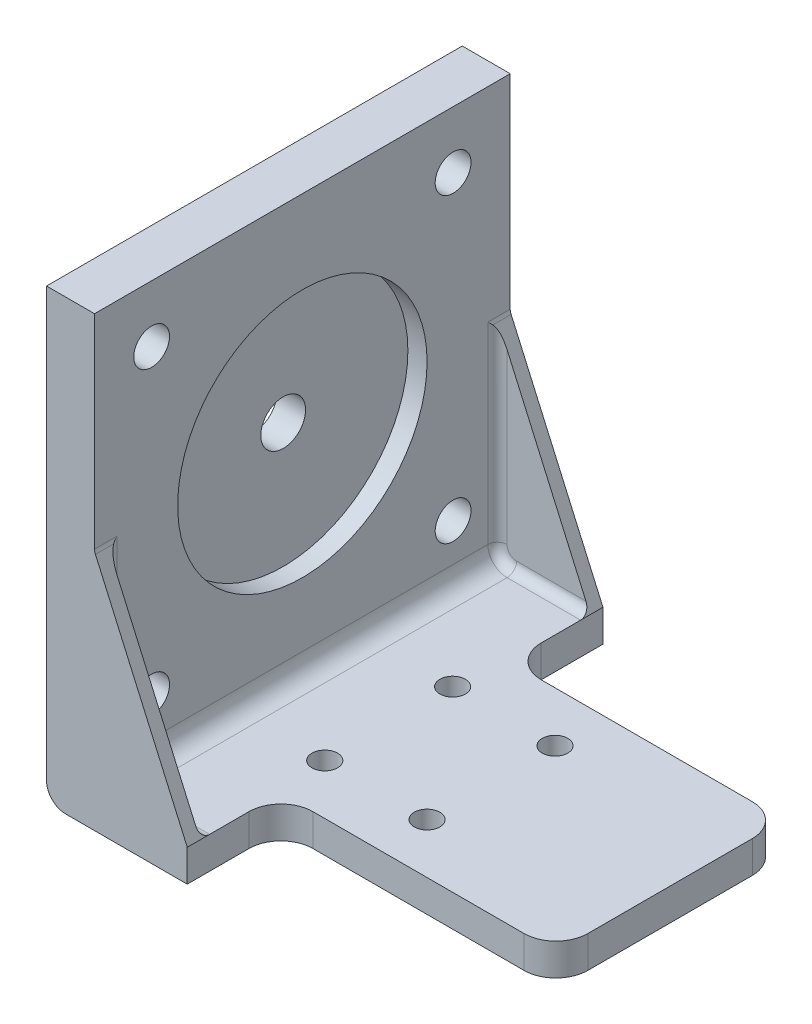
from build123d import *

# Parameters (mm, degrees)
BOSS_EXTRUDE1_DEPTH     = 5
SKETCH2_W               = 7.5
SKETCH2_H               = 65
BOSS_EXTRUDE2_DEPTH     = 65
FILLET2_R               = 3
SKETCH4_R               = 2.8
SKETCH4_R_2             = 3.5
CUT_EXTRUDE2_DEPTH      = 97.241882775
SKETCH6_R               = 2
CUT_EXTRUDE3_DEPTH      = 80.60841664
SKETCH7_R               = 19.5
CUT_EXTRUDE4_DEPTH      = 3
SKETCH8_W               = 2
SKETCH8_H               = 32.5
BOSS_EXTRUDE3_DEPTH     = 32.5
CUT_EXTRUDE5_DEPTH      = 101.902180353
FILLET3_R               = 3
FILLET4_R               = 1.5
CUT_EXTRUDE6_DEPTH      = 5
FILLET5_R               = 5
CUT_EXTRUDE7_DEPTH      = 101.902180353
CUT_EXTRUDE7_DEPTH_BACK = 101.902180353


with BuildPart() as part:
    # Sketch1 → Boss-Extrude1 (new body)
    with BuildSketch(Plane(origin=(0, 0, 0), x_dir=(1, 0, 0), z_dir=(0, 1, 0))):
        with BuildLine():
            Line((-32.5, 32.5), (27.5, 32.5))
            ThreePointArc((27.5, 32.5), (31.035533906, 31.035533906), (32.5, 27.5))
            Line((32.5, 27.5), (32.5, -27.5))
            ThreePointArc((32.5, -27.5), (31.035533906, -31.035533906), (27.5, -32.5))
            Line((27.5, -32.5), (-32.5, -32.5))
            Line((-32.5, -32.5), (-32.5, 32.5))
        make_face()
    extrude(amount=BOSS_EXTRUDE1_DEPTH)

    # Sketch2 → Boss-Extrude2 (add)
    with BuildSketch(Plane(origin=(0, 5, 0), x_dir=(1, 0, 0), z_dir=(0, 1, 0))):
        with Locations((-28.75, 0)):
            Rectangle(SKETCH2_W, SKETCH2_H)
    extrude(amount=BOSS_EXTRUDE2_DEPTH)

    # Fillet2
    fillet2_edges = [part.edges().sort_by_distance(p)[0] for p in [
        (-32.5, 0, 0),
    ]]
    fillet(fillet2_edges, radius=FILLET2_R)

    # Sketch4 → Cut-Extrude2 (cut, through all)
    with BuildSketch(Plane(origin=(-25, 0, 0), x_dir=(0, 0, -1), z_dir=(1, 0, 0))):
        with Locations((23.57, 61.07)):
            Circle(SKETCH4_R)
        with Locations((-23.57, 61.07)):
            Circle(SKETCH4_R)
        with Locations((-23.57, 13.93)):
            Circle(SKETCH4_R)
        with Locations((23.57, 13.93)):
            Circle(SKETCH4_R)
        with Locations((0, 37.5)):
            Circle(SKETCH4_R_2)
    extrude(amount=-CUT_EXTRUDE2_DEPTH, mode=Mode.SUBTRACT)

    # Sketch6 → Cut-Extrude3 (cut, through all)
    with BuildSketch(Plane(origin=(0, 5, 0), x_dir=(1, 0, 0), z_dir=(0, 1, 0))):
        with Locations(Location((4.5, -10, 0), (0, 0, 270))):
            Circle(SKETCH6_R)
        with Locations(Location((-11.5, -10, 0), (0, 0, 270))):
            Circle(SKETCH6_R)
        with Locations(Location((4.5, 10, 0), (0, 0, 90))):
            Circle(SKETCH6_R)
        with Locations(Location((-11.5, 10, 0), (0, 0, 90))):
            Circle(SKETCH6_R)
    extrude(amount=-CUT_EXTRUDE3_DEPTH, mode=Mode.SUBTRACT)

    # Sketch7 → Cut-Extrude4 (cut)
    with BuildSketch(Plane(origin=(-25, 0, 0), x_dir=(0, 0, -1), z_dir=(1, 0, 0))):
        with Locations((0, 37.5)):
            Circle(SKETCH7_R)
    extrude(amount=-CUT_EXTRUDE4_DEPTH, mode=Mode.SUBTRACT)

    # Sketch8 → Boss-Extrude3 (add)
    with BuildSketch(Plane(origin=(-25, 0, 0), x_dir=(0, 0, -1), z_dir=(1, 0, 0))):
        with Locations((-31.5, 21.25)):
            Rectangle(SKETCH8_W, SKETCH8_H)
        with Locations((31.5, 21.25)):
            Rectangle(SKETCH8_W, SKETCH8_H)
    extrude(amount=BOSS_EXTRUDE3_DEPTH)

    # Sketch9 → Cut-Extrude5 (cut, through all)
    with BuildSketch(Plane.XY.offset(32.5)):
        Polygon((-25, 37.5), (7.5, 5), (7.5, 37.5), align=None)
    extrude(amount=-CUT_EXTRUDE5_DEPTH, mode=Mode.SUBTRACT)

    # Fillet3
    fillet3_edges = [part.edges().sort_by_distance(p)[0] for p in [
        (-25, 5, 0),
    ]]
    fillet(fillet3_edges, radius=FILLET3_R)

    # Fillet4
    fillet4_edges = [part.edges().sort_by_distance(p)[0] for p in [
        (-25, 37.5, -31.5),
        (-25, 22.75, -30.5),
        (-7.25, 5, -30.5),
        (7.5, 5, -31.5),
        (-25, 22.75, 30.5),
        (-24.121320344, 5.878679656, 30.5),
        (-24.121320344, 5.878679656, -30.5),
        (-7.25, 5, 30.5),
        (-25, 37.5, 31.5),
        (7.5, 5, 31.5),
    ]]
    fillet(fillet4_edges, radius=FILLET4_R)

    # Sketch10 → Cut-Extrude6 (cut)
    with BuildSketch(Plane.XZ):
        with BuildLine():
            Line((32.5, -17.85), (-10.5, -17.85))
            Line((-10.5, -17.85), (-10.5, -32.5))
            Line((-10.5, -32.5), (27.5, -32.5))
            ThreePointArc((27.5, -32.5), (31.035533906, -31.035533906), (32.5, -27.5))
            Line((32.5, -27.5), (32.5, -17.85))
        make_face()
        with BuildLine():
            Line((-10.5, 17.85), (32.5, 17.85))
            Line((32.5, 17.85), (32.5, 27.5))
            ThreePointArc((32.5, 27.5), (31.035533906, 31.035533906), (27.5, 32.5))
            Line((27.5, 32.5), (-10.5, 32.5))
            Line((-10.5, 32.5), (-10.5, 17.85))
        make_face()
    extrude(amount=-CUT_EXTRUDE6_DEPTH, mode=Mode.SUBTRACT)

    # Fillet5
    fillet5_edges = [part.edges().sort_by_distance(p)[0] for p in [
        (-10.5, 2.5, -17.85),
        (32.5, 2.5, -17.85),
        (-10.5, 2.5, 17.85),
        (32.5, 2.5, 17.85),
    ]]
    fillet(fillet5_edges, radius=FILLET5_R)

    # Sketch12 → Cut-Extrude7 (cut, two sides: drawn at the far end of the back side and taken through both)
    with BuildSketch(Plane(origin=(0, 0, -32.5), x_dir=(-1, 0, 0), z_dir=(0, 0, -1)).offset(-CUT_EXTRUDE7_DEPTH_BACK)):
        with BuildLine():
            Line((-8.121320344, 5), (10.5, 5))
            Line((10.5, 5), (24.857345269, 37.482873932))
            ThreePointArc((24.857345269, 37.482873932), (24.727295275, 37.258913069), (24.560660172, 37.060660172))
            Line((24.560660172, 37.060660172), (-7.060660172, 5.439339828))
            ThreePointArc((-7.060660172, 5.439339828), (-7.547295195, 5.114180701), (-8.121320344, 5))
        make_face()
    extrude(amount=CUT_EXTRUDE7_DEPTH + CUT_EXTRUDE7_DEPTH_BACK, mode=Mode.SUBTRACT)


solid = part.part
